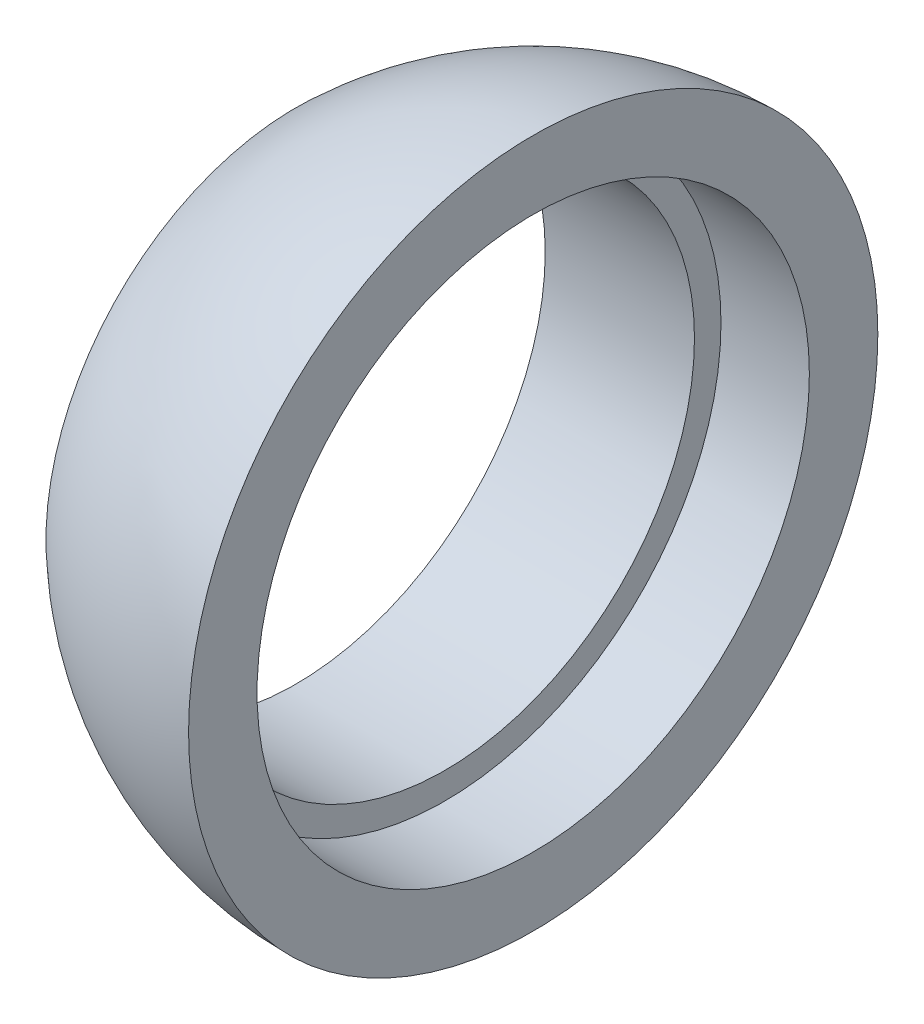
from build123d import *

# Parameters (mm, degrees)
REVOLVE_1_ANGLE          = 180
CUT_EXTRUDE_3_DEPTH      = 14.509996299
CUT_EXTRUDE_3_DEPTH_BACK = 14.509996299
SKETCH_5_W               = 6
SKETCH_5_H               = 20
SKETCH_11_R              = 5.65
CUT_EXTRUDE_7_DEPTH      = 13.325988804
SKETCH_12_R              = 6.25
CUT_EXTRUDE_8_DEPTH      = 2


with BuildPart() as part:
    # 草图1 → 旋转1 (revolve)
    with BuildSketch(Plane(origin=(0, 0, 0), x_dir=(0, 0, -1), z_dir=(1, 0, 0))):
        with BuildLine():
            Line((0, 7.8), (0, -7.8))
            ThreePointArc((0, -7.8), (-7.8, 0), (0, 7.8))
        make_face()
    revolve(axis=Axis((0, 7.8, 0), (0, -1, 0)), revolution_arc=REVOLVE_1_ANGLE)

    # 草图5 → 切除-拉伸3 (cut, two sides: drawn at the far end of the back side and taken through both)
    with BuildSketch(Plane.XY.offset(-CUT_EXTRUDE_3_DEPTH_BACK)):
        with Locations((-8.5, 0.096965289)):
            Rectangle(SKETCH_5_W, SKETCH_5_H)
    extrude(amount=CUT_EXTRUDE_3_DEPTH + CUT_EXTRUDE_3_DEPTH_BACK, mode=Mode.SUBTRACT)

    # 草图11 → 切除-拉伸7 (cut, through all)
    with BuildSketch(Plane(origin=(0, 0, 0), x_dir=(0, 0, -1), z_dir=(1, 0, 0))):
        Circle(SKETCH_11_R)
    extrude(amount=-CUT_EXTRUDE_7_DEPTH, mode=Mode.SUBTRACT)

    # 草图12 → 切除-拉伸8 (cut)
    with BuildSketch(Plane(origin=(0, 0, 0), x_dir=(0, 0, -1), z_dir=(1, 0, 0))):
        Circle(SKETCH_12_R)
    extrude(amount=-CUT_EXTRUDE_8_DEPTH, mode=Mode.SUBTRACT)


solid = part.part
